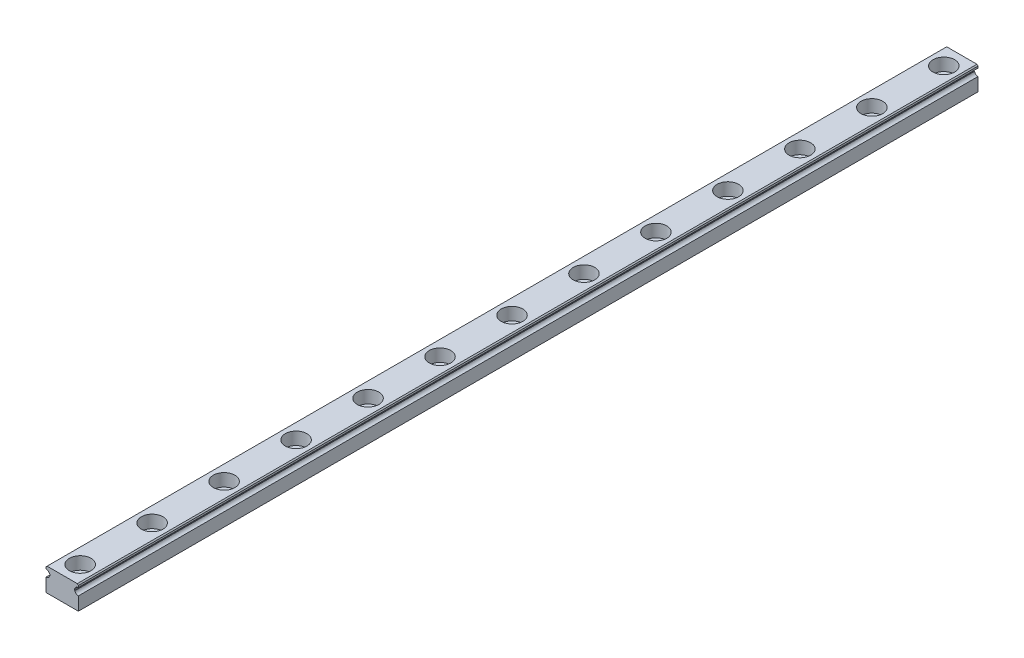
from build123d import *

# Parameters (mm, degrees)
EXTRUDE1_DEPTH  = 250
SKETCH2_R       = 3
EXTRUDE2_DEPTH  = 3.5
SKETCH_R        = 1.75
EXTRUDE3_DEPTH  = 251.124968766
LPATTERN1_COUNT = 40
LPATTERN1_PITCH = 20
CHAMFER1_SIZE   = 0.3


with BuildPart() as part:
    # Sketch1 → Extrude1 (new body)
    with BuildSketch(Plane.XY):
        with BuildLine():
            Line((-4.5, -3.25), (4.5, -3.25))
            Line((4.5, -3.25), (4.5, 0.45))
            ThreePointArc((4.5, 0.45), (3.887627564, 0.659430585), (3.531754163, 1.2))
            Line((3.531754163, 1.2), (3.4, 1.2))
            Line((3.4, 1.2), (3.4, 1.7))
            Line((3.4, 1.7), (3.531754163, 1.7))
            ThreePointArc((3.531754163, 1.7), (3.887627564, 2.240569415), (4.5, 2.45))
            Line((4.5, 2.45), (4.5, 3.25))
            Line((4.5, 3.25), (-4.5, 3.25))
            Line((-4.5, 3.25), (-4.5, 2.45))
            ThreePointArc((-4.5, 2.45), (-3.887627564, 2.240569415), (-3.531754163, 1.7))
            Line((-3.531754163, 1.7), (-3.4, 1.7))
            Line((-3.4, 1.7), (-3.4, 1.2))
            Line((-3.4, 1.2), (-3.531754163, 1.2))
            ThreePointArc((-3.531754163, 1.2), (-3.887627564, 0.659430585), (-4.5, 0.45))
            Line((-4.5, 0.45), (-4.5, -3.25))
        make_face()
    extrude(amount=EXTRUDE1_DEPTH)

    # Sketch2 → Extrude2 (cut)
    with BuildSketch(Plane(origin=(0, 3.25, 0), x_dir=(1, 0, 0), z_dir=(0, 1, 0))):
        with Locations((0, -5)):
            Circle(SKETCH2_R)
    extrude2 = extrude(amount=-EXTRUDE2_DEPTH, mode=Mode.SUBTRACT)

    # Sketch → Extrude3 (cut, through all)
    with BuildSketch(Plane(origin=(0, 3.25, 0), x_dir=(1, 0, 0), z_dir=(0, 1, 0))):
        with Locations((0, -5)):
            Circle(SKETCH_R)
    extrude3 = extrude(amount=-EXTRUDE3_DEPTH, mode=Mode.SUBTRACT)

    # LPattern1: Extrude2, Extrude3 ×40
    with Locations(*[(0, 0, i * LPATTERN1_PITCH) for i in range(1, LPATTERN1_COUNT)]):
        add(extrude2, mode=Mode.SUBTRACT)
        add(extrude3, mode=Mode.SUBTRACT)

    # Chamfer1
    chamfer1_edges = [part.edges().sort_by_distance(p)[0] for p in [
        (4.5, 3.25, 125),
        (-4.5, 3.25, 125),
    ]]
    chamfer(chamfer1_edges, length=CHAMFER1_SIZE)


solid = part.part
